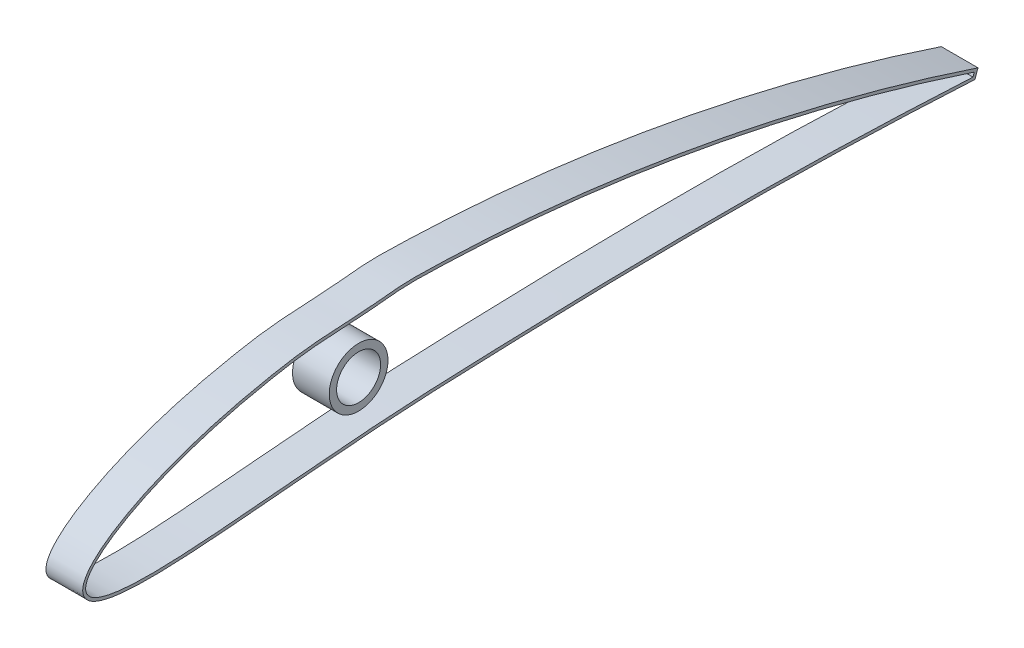
from build123d import *

# Parameters (mm, degrees)
Y_KSEKLIK_EKSTR_ZYON1_DEPTH = 5
IZIM3_R                     = 8
IZIM3_R_2                   = 6
Y_KSEKLIK_EKSTR_ZYON2_DEPTH = 5


with BuildPart() as part:
    # Çizim2 → Yükseklik-Ekstrüzyon1 (new, symmetric)
    with BuildSketch(Plane(origin=(0, 0, 0), x_dir=(0, 0, -1), z_dir=(1, 0, 0))):
        with BuildLine():
            Line((168.719684671, 2.46412375), (167.911154677, 0.117538896))
            add(Edge.make_bspline(
                [(168.719684671, 2.46412375), (167.321383564, 2.929260507), (163.988905751, 4.026630563), (158.321527554, 5.828082739), (151.348387177, 7.950217456), (143.265278658, 10.286048529), (134.149889828, 12.762063243), (124.094059073, 15.303573267), (113.198829774, 17.830234841), (101.580770479, 20.278566884), (89.361150309, 22.569521928), (76.671815163, 24.634786046), (63.651841273, 26.424325734), (50.448474038, 27.866981254), (37.199785649, 28.968364385), (23.978890103, 29.551649783), (12.87894554, 29.992827964), (0.225940682, 28.41628749), (-11.998124761, 28.302706132), (-25.304758066, 25.879475028), (-35.750397981, 23.548871617), (-45.145305493, 20.779185266), (-53.385145813, 17.763228388), (-60.379983551, 14.607083651), (-66.063865887, 11.435949034), (-70.411499794, 8.361113118), (-73.399594662, 5.449581839), (-75.119613032, 2.692175374), (-75.27553604, -0.083056829), (-73.630427751, -2.306444588), (-70.746432099, -3.69870435), (-66.781320516, -4.612773405), (-61.672887406, -5.091878186), (-55.472039606, -5.187793892), (-48.238135063, -4.940822505), (-40.05258842, -4.411864994), (-30.999460406, -3.663495225), (-21.166784447, -2.781262074), (-10.643166536, -1.84059283), (0.480224023, -0.923049069), (12.111030904, -0.113920583), (24.245411954, 0.495797589), (36.775333526, 0.92646578), (49.569565336, 1.370457836), (62.405514091, 1.725134453), (75.1399673, 1.981969976), (87.637107731, 2.126018665), (99.75930879, 2.151718515), (111.371446336, 2.066575855), (122.342620607, 1.8899484), (132.546289305, 1.627220994), (141.862896275, 1.324193284), (150.18597107, 0.985789618), (157.399298977, 0.66348072), (163.216617809, 0.335517929), (166.543163084, 0.213579413), (167.911154677, 0.117538896)],
                knots=[0.013013732, 0.013013732, 0.013013732, 0.013013732, 0.021602335, 0.033461911, 0.047672056, 0.064082402, 0.082497656, 0.102720886, 0.124529185, 0.147678146, 0.17191548, 0.196981711, 0.222600677, 0.24850097, 0.274389742, 0.300046253, 0.325695497, 0.338902545, 0.37426912, 0.39670105, 0.417566883, 0.436644478, 0.453735151, 0.468671007, 0.481320643, 0.491622104, 0.499607325, 0.505537918, 0.5101767, 0.514815988, 0.520693402, 0.528508065, 0.538457945, 0.550535007, 0.564635893, 0.580631046, 0.598338083, 0.61757799, 0.638168281, 0.659916338, 0.682626745, 0.706115695, 0.730722829, 0.755696112, 0.78072806, 0.805561174, 0.829929519, 0.853567816, 0.876211011, 0.897608255, 0.917517998, 0.93569726, 0.951941865, 0.966046585, 0.977839565, 0.985735276, 0.985735276, 0.985735276, 0.985735276], degree=3))
        make_face()
        with BuildLine():
            Line((167.699764542, 1.959810812), (167.35383773, 0.955832454))
            add(Edge.make_bspline(
                [(167.699764542, 1.959810812), (157.841528872, 5.226510964), (137.934402673, 11.197883472), (107.622301434, 18.47392316), (82.063018512, 23.115820066), (64.050785288, 25.556840634), (53.729223088, 26.698413454), (45.973054342, 27.437922873), (38.209970486, 28.04570746), (30.445060378, 28.467850923), (22.642616721, 28.809267464), (16.158110877, 29.029907852), (11.027470043, 28.860157932), (7.186719419, 28.481705027), (3.279338865, 28.065549732), (-1.939454517, 27.705857184), (-8.438706084, 27.403436828), (-16.130852393, 26.710437368), (-23.774819218, 25.33324936), (-31.39445743, 23.725450112), (-38.913804285, 21.816555979), (-46.329789372, 19.507882138), (-53.597545881, 16.800144896), (-59.477024248, 14.130288139), (-63.997811485, 11.673524856), (-67.26585886, 9.632146227), (-70.32412364, 7.339225268), (-72.5656392, 5.121987581), (-73.758396009, 3.350081933), (-74.18324812, 2.300094526), (-74.35834699, 1.470194232), (-74.356697091, 0.652419619), (-74.103404385, -0.297543454), (-73.233159274, -1.431052317), (-71.76175921, -2.34452827), (-69.420692004, -3.211990236), (-66.327570133, -3.836409072), (-62.498458749, -4.20531959), (-58.634982093, -4.34779717), (-54.759079718, -4.340131103), (-49.58381503, -4.19273415), (-43.109415526, -3.824989059), (-35.342625264, -3.228452843), (-27.574904998, -2.554302146), (-17.216052882, -1.6222474), (-4.25796914, -0.47985767), (11.319701993, 0.67028533), (26.928371397, 1.409477371), (42.521333179, 1.92810076), (58.123498141, 2.428708081), (78.93230588, 2.881024214), (99.749788175, 3.007862655), (120.566269014, 2.742796845), (136.172178707, 2.339216241), (147.877534909, 1.88878861), (155.668345508, 1.540387248), (159.57888962, 1.340194372), (162.829008951, 1.16530919), (165.390438597, 1.05880449), (166.702333122, 0.995790979), (167.35383773, 0.955832454)],
                knots=[0.014586409, 0.014586409, 0.014586409, 0.014586409, 0.075210058, 0.135833707, 0.196457356, 0.22676918, 0.241925092, 0.257081004, 0.272236917, 0.287392829, 0.302548741, 0.317704653, 0.325282609, 0.332860565, 0.340438522, 0.348016478, 0.36317239, 0.378328302, 0.393484214, 0.408640127, 0.423796039, 0.438951951, 0.454107863, 0.469263775, 0.476841731, 0.484419688, 0.491997644, 0.4995756, 0.503364578, 0.505259067, 0.507153556, 0.509048045, 0.510942534, 0.514731512, 0.51852049, 0.522309468, 0.529887424, 0.53746538, 0.545043336, 0.552621293, 0.560199249, 0.575355161, 0.590511073, 0.605666985, 0.620822898, 0.651134722, 0.681446546, 0.711758371, 0.742070195, 0.77238202, 0.802693844, 0.863317493, 0.893629317, 0.923941142, 0.954252966, 0.961830922, 0.969408878, 0.976986834, 0.980775813, 0.984564791, 0.984564791, 0.984564791, 0.984564791], degree=3))
        make_face(mode=Mode.SUBTRACT)
    extrude(amount=Y_KSEKLIK_EKSTR_ZYON1_DEPTH, both=True)


with BuildPart() as body_2:
    # Çizim3 → Yükseklik-Ekstrüzyon2 (new, symmetric)
    with BuildSketch(Plane(origin=(0, 0, 0), x_dir=(0, 0, -1), z_dir=(1, 0, 0))):
        with Locations((0, 13.831638279)):
            Circle(IZIM3_R)
        with Locations((0, 13.831638279)):
            Circle(IZIM3_R_2, mode=Mode.SUBTRACT)
    extrude(amount=Y_KSEKLIK_EKSTR_ZYON2_DEPTH, both=True)


solid = Compound([part.part, body_2.part])
